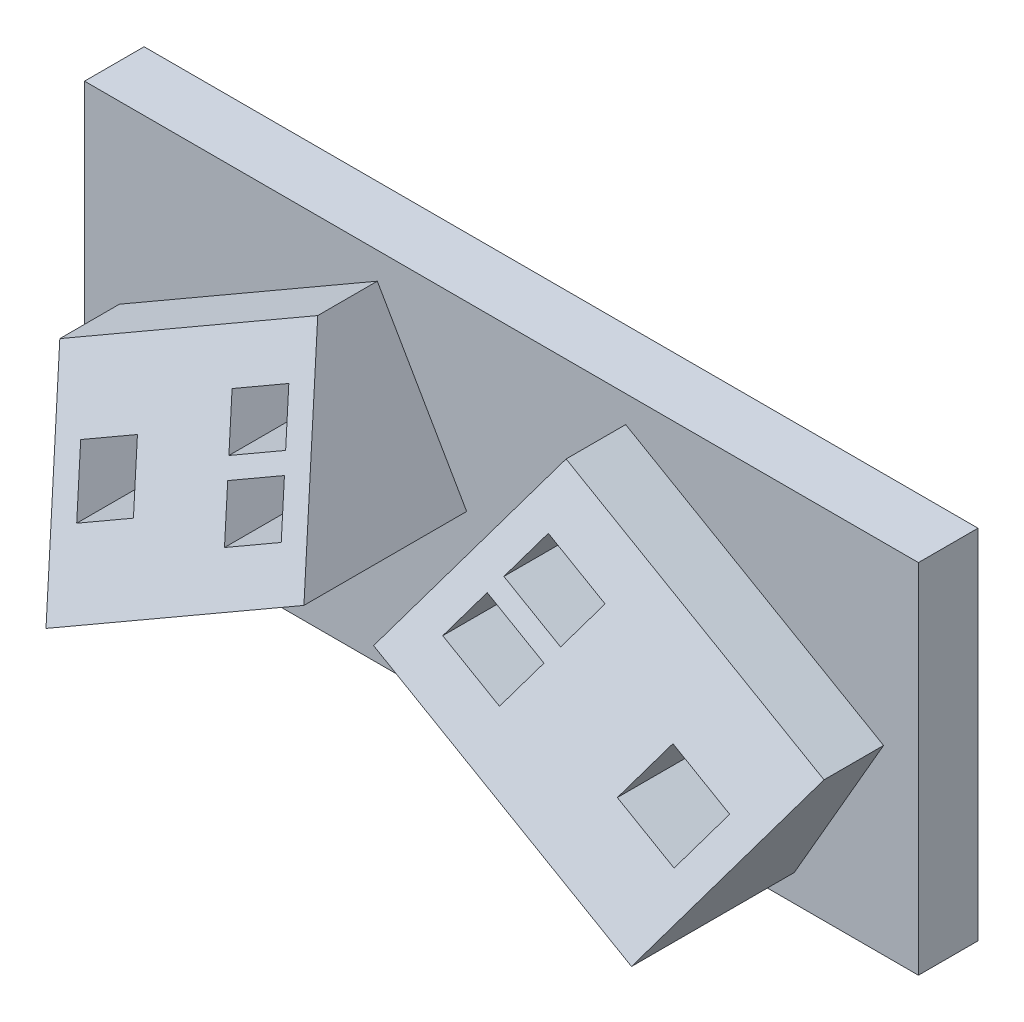
from build123d import *

# Parameters (mm, degrees)
SKETCH1_W           = 14
SKETCH1_H           = 6
BOSS_EXTRUDE1_DEPTH = 1
BOSS_EXTRUDE2_DEPTH = 10
CUT_EXTRUDE1_DEPTH  = 5
CUT_EXTRUDE4_DEPTH  = 5


with BuildPart() as part:
    # Sketch1 → Boss-Extrude1 (new body)
    with BuildSketch(Plane.XY):
        with Locations((-28.980109017, 20.469258927)):
            Rectangle(SKETCH1_W, SKETCH1_H)
    extrude(amount=BOSS_EXTRUDE1_DEPTH)

    # 3DSketch3 → Boss-Extrude2 (add)
    with BuildSketch(Plane(origin=(-35.395172526, 20.518297033, 1), x_dir=(0.9998585349462691, -0.016819931483230154, 0), z_dir=(0, 0, -1))):
        Polygon((0, 0), (4.287464629, -2.572478777), (5.830951895, 0), (1.543487266, 2.572478777), align=None)
    boss_extrude2 = extrude(amount=-BOSS_EXTRUDE2_DEPTH)

    # Sketch5 → Cut-Extrude1 (cut)
    with BuildSketch(Plane(origin=(-17.661696158, -10.196985031, 0), x_dir=(0, 0, 1), z_dir=(-0.8660254037844383, -0.5000000000000009, 0))):
        Polygon((3.732050808, 32.466952736), (11, 32.466952736), (11, 35.466952736), (2, 35.466952736), align=None)
    cut_extrude1 = extrude(amount=-CUT_EXTRUDE1_DEPTH, mode=Mode.SUBTRACT)

    # Sketch8 → Cut-Extrude4 (cut, symmetric, along a direction that is not the sketch's normal)
    with BuildSketch(Plane(origin=(-4.866381794, 8.428820516, 16.857641032), x_dir=(0.9682458365518544, 0.11180339887498851, 0.2236067977499786), z_dir=(-0.24999999999999922, 0.43301270189221724, 0.8660254037844398))):
        Polygon((-27.780523262, 17.561354254), (-26.796645351, 18.05329321), (-27.154416227, 18.768834963), (-28.138294138, 18.276896007), align=None)
        Polygon((-27.288588307, 16.577484344), (-26.304710396, 17.0694233), (-26.662481272, 17.784965053), (-27.646359183, 17.293026097), align=None)
        Polygon((-30.530878873, 16.577488345), (-30.083665278, 15.683061154), (-29.099795368, 16.174996109), (-29.547008963, 17.0694233), align=None)
    cut_extrude4 = extrude(amount=CUT_EXTRUDE4_DEPTH, dir=(0, 0, 1), both=True, mode=Mode.SUBTRACT)

    # Mirror1: Boss-Extrude2, Cut-Extrude1, Cut-Extrude4 across plane
    add(boss_extrude2.mirror(Plane.ZY.offset(28.980109017)))
    add(cut_extrude1.mirror(Plane.ZY.offset(28.980109017)), mode=Mode.SUBTRACT)
    add(cut_extrude4.mirror(Plane.ZY.offset(28.980109017)), mode=Mode.SUBTRACT)


solid = part.part
